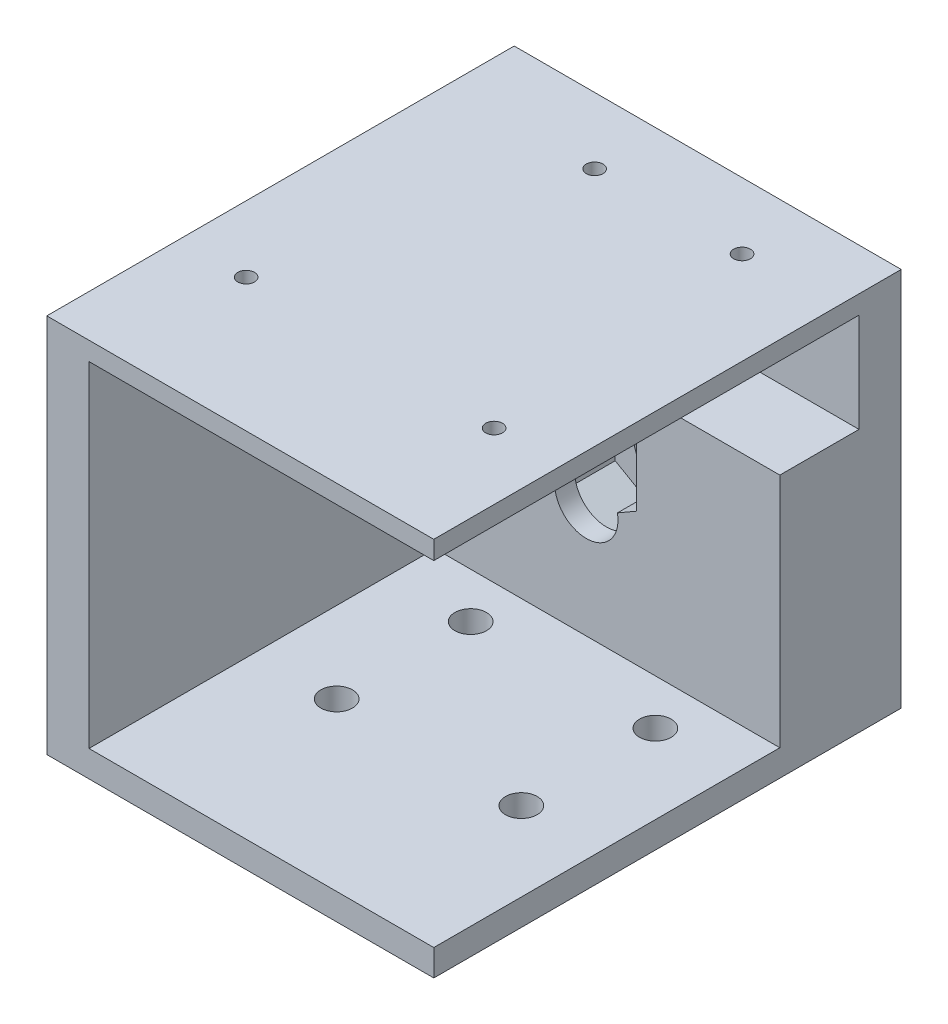
from build123d import *

# Parameters (mm, degrees)
SKETCH2_W           = 73.34
SKETCH2_H           = 88.58
BOSS_EXTRUDE1_DEPTH = 3.5
SKETCH1_R           = 1.5875
CUT_EXTRUDE1_DEPTH  = 3.5
BOSS_EXTRUDE2_DEPTH = 63.5
SKETCH4_W           = 73.34
SKETCH4_H           = 88.58
BOSS_EXTRUDE3_DEPTH = 5
SKETCH5_R           = 3
CUT_EXTRUDE2_DEPTH  = 5
SKETCH6_W           = 65.34
SKETCH6_H           = 44.75
BOSS_EXTRUDE4_DEPTH = 15
CUT_EXTRUDE3_DEPTH  = 126.25610564
SKETCH11_R          = 6
CUT_EXTRUDE4_DEPTH  = 131.546436183
CUT_EXTRUDE5_DEPTH  = 11.2


with BuildPart() as part:
    # Sketch2 → Boss-Extrude1 (new body)
    with BuildSketch(Plane(origin=(0, 0, 0), x_dir=(1, 0, 0), z_dir=(0, 1, 0))):
        with Locations((-26.67, 34.29)):
            Rectangle(SKETCH2_W, SKETCH2_H)
    extrude(amount=-BOSS_EXTRUDE1_DEPTH)

    # Sketch1 → Cut-Extrude1 (cut)
    with BuildSketch(Plane(origin=(0, 0, 0), x_dir=(1, 0, 0), z_dir=(0, 1, 0))):
        with Locations(Location((-7.62, 66.04, 0), (0, 0, 270))):
            Circle(SKETCH1_R)
        with Locations(Location((-35.56, 66.04, 0), (0, 0, 270))):
            Circle(SKETCH1_R)
        with Locations(Location((-2.54, 13.97, 0), (0, 0, 270))):
            Circle(SKETCH1_R)
        with Locations(Location((-50.8, 15.24, 0), (0, 0, 270))):
            Circle(SKETCH1_R)
    extrude(amount=-CUT_EXTRUDE1_DEPTH, mode=Mode.SUBTRACT)

    # Sketch3 → Boss-Extrude2 (add)
    with BuildSketch(Plane.XZ.offset(3.5)):
        Polygon((10, -78.58), (-63.34, -78.58), (-63.34, 10), (-55.34, 10), (-55.34, -70.58), (10, -70.58), align=None)
    extrude(amount=BOSS_EXTRUDE2_DEPTH)

    # Sketch4 → Boss-Extrude3 (add)
    with BuildSketch(Plane.XZ.offset(67)):
        with Locations((-26.67, -34.29)):
            Rectangle(SKETCH4_W, SKETCH4_H)
    extrude(amount=BOSS_EXTRUDE3_DEPTH)

    # Sketch5 → Cut-Extrude2 (cut)
    with BuildSketch(Plane.XZ.offset(72)):
        with Locations(Location((-5, -21.59, 0), (0, 0, 270))):
            Circle(SKETCH5_R)
        with Locations(Location((-5, -46.99, 0), (0, 0, 270))):
            Circle(SKETCH5_R)
        with Locations(Location((-40, -21.59, 0), (0, 0, 270))):
            Circle(SKETCH5_R)
        with Locations(Location((-40, -46.99, 0), (0, 0, 270))):
            Circle(SKETCH5_R)
    extrude(amount=-CUT_EXTRUDE2_DEPTH, mode=Mode.SUBTRACT)

    # Sketch6 → Boss-Extrude4 (add)
    with BuildSketch(Plane.XY.offset(-70.58)):
        with Locations((-22.67, -44.625)):
            Rectangle(SKETCH6_W, SKETCH6_H)
    extrude(amount=BOSS_EXTRUDE4_DEPTH)

    # Sketch9 → Cut-Extrude3 (cut, through all)
    with BuildSketch(Plane.XY.offset(-70.58)):
        Polygon((-17.145, -41.747783942), (-17.145, -30.749261314), (-26.67, -25.25), (-36.195, -30.749261314), (-36.195, -41.747783942), (-26.67, -47.247045256), align=None)
    extrude(amount=CUT_EXTRUDE3_DEPTH, mode=Mode.SUBTRACT)

    # Sketch11 → Cut-Extrude4 (cut, through all)
    with BuildSketch(Plane(origin=(0, 0, -78.58), x_dir=(-1, 0, 0), z_dir=(0, 0, -1))):
        with Locations((26.67, -45)):
            Circle(SKETCH11_R)
    extrude(amount=-CUT_EXTRUDE4_DEPTH, mode=Mode.SUBTRACT)

    # Sketch12 → Cut-Extrude5 (cut)
    with BuildSketch(Plane.XY.offset(-70.58)):
        Polygon((-17.145, -39.500738686), (-26.67, -34.001477372), (-36.195, -39.500738686), (-36.195, -50.499261314), (-26.67, -55.998522628), (-17.145, -50.499261314), align=None)
    extrude(amount=CUT_EXTRUDE5_DEPTH, mode=Mode.SUBTRACT)


solid = part.part
